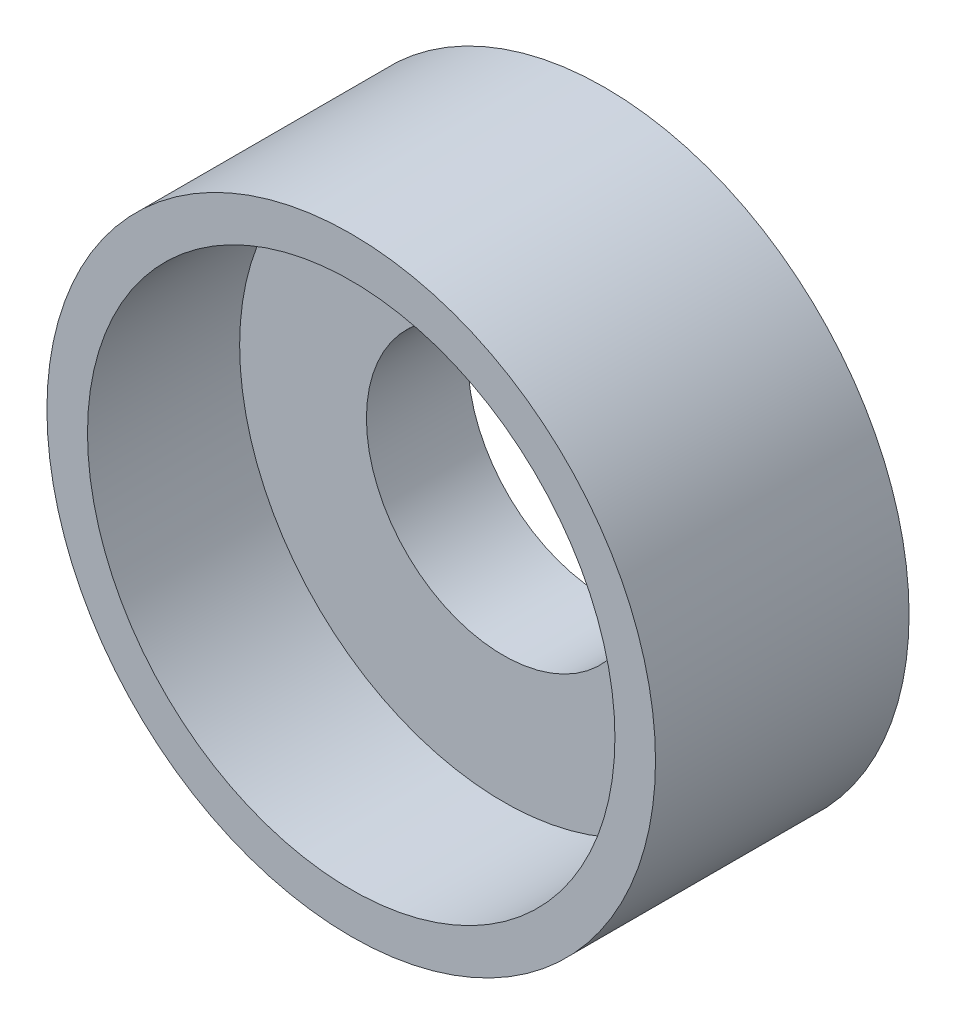
from build123d import *

# Parameters (mm, degrees)
SKETCH1_R           = 30
SKETCH1_R_2         = 26
BOSS_EXTRUDE1_DEPTH = 25
SKETCH2_R           = 26
SKETCH2_R_2         = 13.5
BOSS_EXTRUDE2_DEPTH = 10


with BuildPart() as part:
    # Sketch1 → Boss-Extrude1 (new body)
    with BuildSketch(Plane.XY):
        Circle(SKETCH1_R)
        Circle(SKETCH1_R_2, mode=Mode.SUBTRACT)
    extrude(amount=BOSS_EXTRUDE1_DEPTH)

    # Sketch2 → Boss-Extrude2 (add)
    with BuildSketch(Plane(origin=(0, 0, 0), x_dir=(-1, 0, 0), z_dir=(0, 0, -1))):
        Circle(SKETCH2_R)
        Circle(SKETCH2_R_2, mode=Mode.SUBTRACT)
    extrude(amount=-BOSS_EXTRUDE2_DEPTH)


solid = part.part
